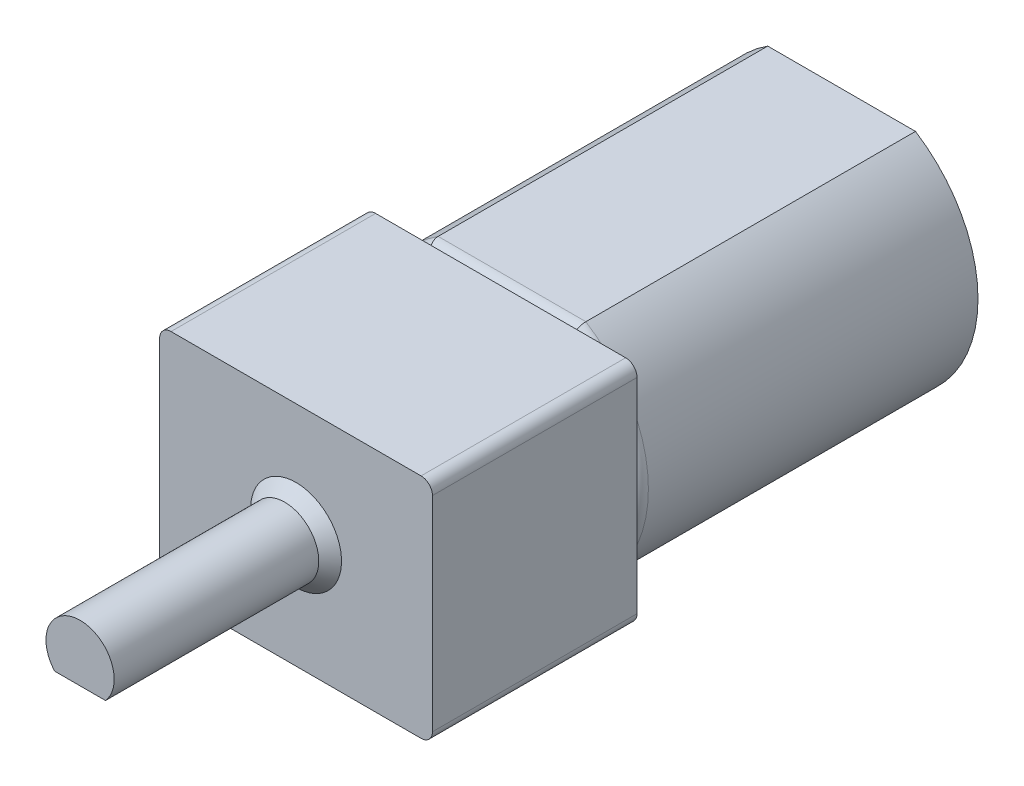
from build123d import *

# Parameters (mm, degrees)
SKETCH1_W           = 12
SKETCH1_H           = 10
BOSS_EXTRUDE1_DEPTH = 15
CUT_EXTRUDE1_DEPTH  = 17.911534525
SKETCH3_R           = 2.5
BOSS_EXTRUDE2_DEPTH = 1.25
SKETCH4_W           = 1.25
SKETCH4_H           = 1.5
SKETCH4_R           = 0.125
BOSS_EXTRUDE3_DEPTH = 0.25
FILLET2_R           = 0.5
SKETCH5_W           = 12
SKETCH5_H           = 10
BOSS_EXTRUDE4_DEPTH = 9
FILLET1_R           = 0.5
SKETCH6_R           = 1.5
BOSS_EXTRUDE5_DEPTH = 9.5
CHAMFER1_SIZE       = 0.5
CUT_EXTRUDE2_START  = -6
CUT_EXTRUDE2_DEPTH  = 6


with BuildPart() as part:
    # Sketch1 → Boss-Extrude1 (new body)
    with BuildSketch(Plane.XY):
        Rectangle(SKETCH1_W, SKETCH1_H)
    extrude(amount=BOSS_EXTRUDE1_DEPTH)

    # Sketch2 → Cut-Extrude1 (cut, through all)
    with BuildSketch(Plane.XY.offset(15)):
        with BuildLine():
            ThreePointArc((-6, 0), (-5.267141914, 2.853178053), (-3.25, 5))
            Line((-3.25, 5), (-6, 5))
            Line((-6, 5), (-6, 0))
        make_face()
        with BuildLine():
            ThreePointArc((-3.25, -5), (-5.267141914, -2.853178053), (-6, 0))
            Line((-6, 0), (-6, -5))
            Line((-6, -5), (-3.25, -5))
        make_face()
    cut_extrude1 = extrude(amount=-CUT_EXTRUDE1_DEPTH, mode=Mode.SUBTRACT)

    # Mirror1: Cut-Extrude1 across plane
    add(cut_extrude1.mirror(Plane(origin=(0, 0, 0), x_dir=(0, 0, 1), z_dir=(1, 0, 0))), mode=Mode.SUBTRACT)

    # Sketch3 → Boss-Extrude2 (add)
    with BuildSketch(Plane(origin=(0, 0, 0), x_dir=(-1, 0, 0), z_dir=(0, 0, -1))):
        Circle(SKETCH3_R)
    extrude(amount=BOSS_EXTRUDE2_DEPTH)

    # Sketch4 → Boss-Extrude3 (add)
    with BuildSketch(Plane(origin=(4, 0, 0), x_dir=(0, 0, -1), z_dir=(1, 0, 0))):
        with Locations((0.625, 0)):
            Rectangle(SKETCH4_W, SKETCH4_H)
        with Locations((0.625, 0)):
            Circle(SKETCH4_R, mode=Mode.SUBTRACT)
    boss_extrude3 = extrude(amount=-BOSS_EXTRUDE3_DEPTH)

    # Mirror2: Boss-Extrude3 across plane
    add(boss_extrude3.mirror(Plane(origin=(0, 0, 0), x_dir=(0, 0, 1), z_dir=(1, 0, 0))))

    # Fillet2
    fillet2_edges = [part.edges().sort_by_distance(p)[0] for p in [
        (-6, 0, 15),
        (0, -5, 15),
        (0, 5, 15),
        (6, 0, 15),
    ]]
    fillet(fillet2_edges, radius=FILLET2_R)

    # Sketch5 → Boss-Extrude4 (add)
    with BuildSketch(Plane.XY.offset(15)):
        Rectangle(SKETCH5_W, SKETCH5_H)
    extrude(amount=BOSS_EXTRUDE4_DEPTH)

    # Fillet1
    fillet1_edges = [part.edges().sort_by_distance(p)[0] for p in [
        (6, 5, 19.5),
        (-6, 5, 19.5),
        (-6, -5, 19.5),
        (6, -5, 19.5),
    ]]
    fillet(fillet1_edges, radius=FILLET1_R)

    # Sketch6 → Boss-Extrude5 (add)
    with BuildSketch(Plane.XY.offset(24)):
        Circle(SKETCH6_R)
    extrude(amount=BOSS_EXTRUDE5_DEPTH)

    # Chamfer1
    chamfer1_edges = [part.edges().sort_by_distance(p)[0] for p in [
        (-1.5, 0, 24),
    ]]
    chamfer(chamfer1_edges, length=CHAMFER1_SIZE)

    # Sketch7 → Cut-Extrude2 (cut)
    with BuildSketch(Plane.XY.offset(33.5).offset(CUT_EXTRUDE2_START)):
        with BuildLine():
            Line((-1.118033989, -1), (1.118033989, -1))
            ThreePointArc((1.118033989, -1), (0, -1.5), (-1.118033989, -1))
        make_face()
    extrude(amount=CUT_EXTRUDE2_DEPTH, mode=Mode.SUBTRACT)


solid = part.part
